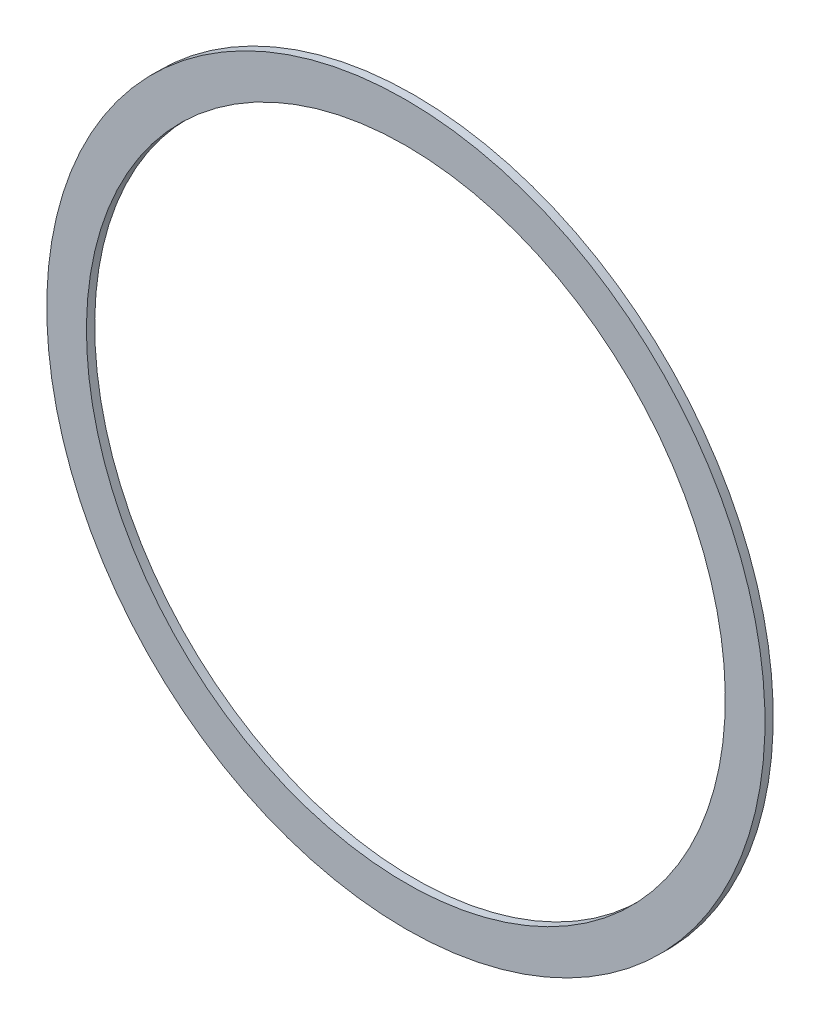
from build123d import *

# Parameters (mm, degrees)
SKETCH2_R           = 137.922
SKETCH2_R_2         = 122.682
BOSS_EXTRUDE2_DEPTH = 1.5875


with BuildPart() as part:
    # Sketch2 → Boss-Extrude2 (new, symmetric)
    with BuildSketch(Plane(origin=(248.273568551, -245.01347209, 0), x_dir=(0, -1, 0), z_dir=(0, 0, -1))):
        with Locations(Location((-257.71347209, 248.273568551, 0), (0, 0, 180))):
            Circle(SKETCH2_R)
        with Locations(Location((-257.71347209, 248.273568551, 0), (0, 0, 180))):
            Circle(SKETCH2_R_2, mode=Mode.SUBTRACT)
    extrude(amount=BOSS_EXTRUDE2_DEPTH, both=True)


solid = part.part
